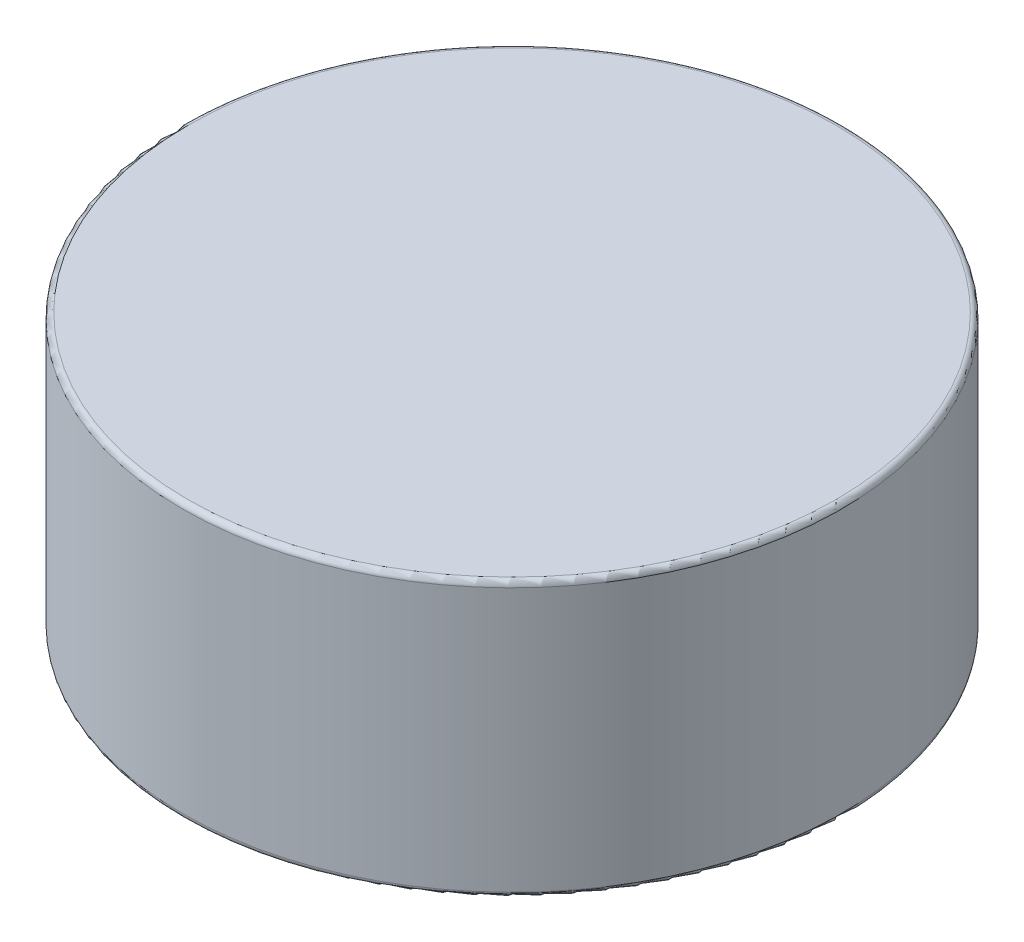
from build123d import *

# Parameters (mm, degrees)
SKETCH_1_R      = 3
EXTRUDE_1_DEPTH = 2.5
FILLET_1_R      = 0.05
FILLET_2_R      = 0.05


with BuildPart() as part:
    # Эскиз1 → Бобышка-Вытянуть1 (new body)
    with BuildSketch(Plane(origin=(0, 0, 0), x_dir=(1, 0, 0), z_dir=(0, 1, 0))):
        with Locations(Location((0, 0, 0), (0, 0, 270))):
            Circle(SKETCH_1_R)
    extrude(amount=EXTRUDE_1_DEPTH)

    # Скругление1
    fillet_1_edges = [part.edges().sort_by_distance(p)[0] for p in [
        (0, 2.5, -3),
    ]]
    fillet(fillet_1_edges, radius=FILLET_1_R)

    # Скругление2
    fillet_2_edges = [part.edges().sort_by_distance(p)[0] for p in [
        (0, 0, -3),
    ]]
    fillet(fillet_2_edges, radius=FILLET_2_R)


solid = part.part
